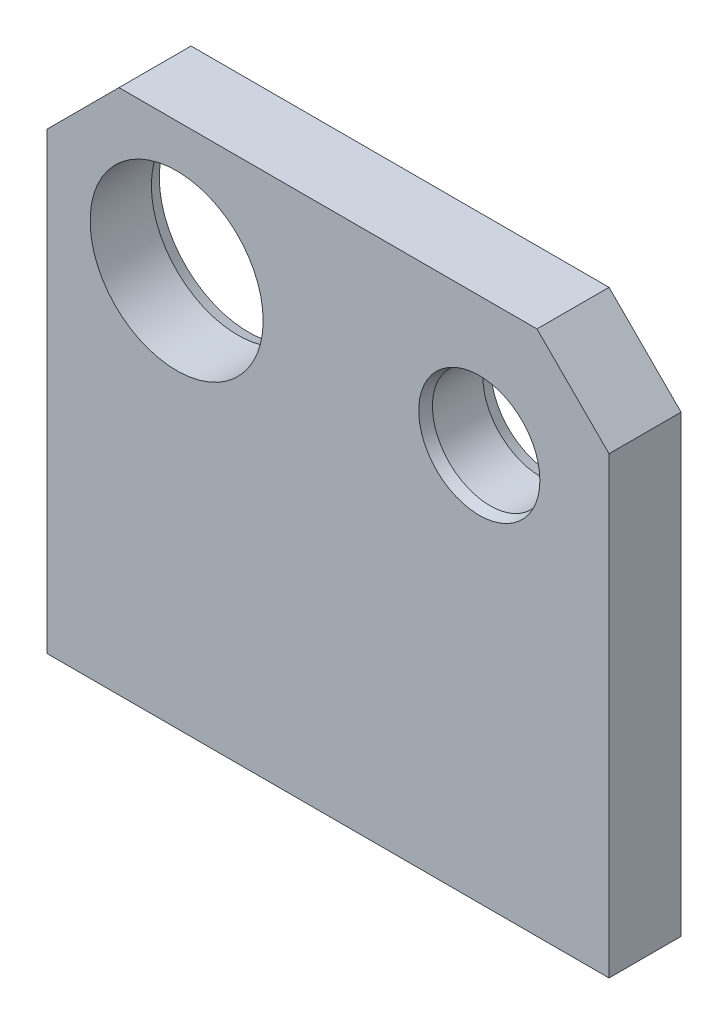
from build123d import *
from OCP.BRepFilletAPI import BRepFilletAPI_MakeChamfer

# Parameters (mm, degrees)
SKETCH1_W             = 78
SKETCH1_H             = 73
EXTRUDE1_DEPTH        = 10
SKETCH3_R             = 12.0065
F_24DIA_HOLE_DEPTH    = 108.29864864
M6_TAPPED_HOLE1_D     = 5
M6_TAPPED_HOLE1_DEPTH = 15
M6_TAPPED_HOLE1_TIP   = 1.502151548
SKETCH7_R             = 8.0045
F_16DIA_HOLE_DEPTH    = 108.29864864
CHAMFER1_SIZE         = 10
CHAMFER2_SIZE         = 1.5
CHAMFER2_SIZE2        = 0.401923789
CHAMFER3_SIZE         = 1.5
CHAMFER3_SIZE2        = 0.401923789


with BuildPart() as part:
    # Sketch1 → Extrude1 (new body)
    with BuildSketch(Plane.XY):
        with Locations((39, 36.5)):
            Rectangle(SKETCH1_W, SKETCH1_H)
    extrude(amount=EXTRUDE1_DEPTH)

    # Sketch3 → 24dia Hole (cut, through all)
    with BuildSketch(Plane.XY.offset(10)):
        with Locations((18, 55)):
            Circle(SKETCH3_R)
    extrude(amount=-F_24DIA_HOLE_DEPTH, mode=Mode.SUBTRACT)

    # M6 Tapped Hole1
    with Locations(Plane(origin=(5, 0, 5), x_dir=(0, 0, -1), z_dir=(0, -1, 0))):
        with Locations((0, 0), (0, 68), (1.921473379, -8.468632325)):
            Hole(M6_TAPPED_HOLE1_D / 2, depth=M6_TAPPED_HOLE1_DEPTH)
            with Locations((0, 0, -(M6_TAPPED_HOLE1_DEPTH + M6_TAPPED_HOLE1_TIP / 2))):  # 118° drill point
                Cone(0, M6_TAPPED_HOLE1_D / 2, M6_TAPPED_HOLE1_TIP, mode=Mode.SUBTRACT)

    # Sketch7 → 16dia hole (cut, through all)
    with BuildSketch(Plane.XY.offset(10)):
        with Locations((60, 55)):
            Circle(SKETCH7_R)
    extrude(amount=-F_16DIA_HOLE_DEPTH, mode=Mode.SUBTRACT)

    # Chamfer1
    chamfer1_edges = [part.edges().sort_by_distance(p)[0] for p in [
        (0, 73, 5),
        (78, 73, 5),
    ]]
    chamfer(chamfer1_edges, length=CHAMFER1_SIZE)

    # Chamfer2: one chamfer whose edges measure the first distance from different faces: ONE call of the kernel's chamfer builder (chamfer() names one face for all edges)
    chamfer2_edges_1 = [part.edges().sort_by_distance(p)[0] for p in [
        (5.9935, 55, 0),
    ]]
    chamfer2_side_1 = [part.faces().sort_by_distance(p)[0] for p in [
        (5.9935, 55, 5),
    ]]
    chamfer2_edges_2 = [part.edges().sort_by_distance(p)[0] for p in [
        (51.9955, 55, 0),
    ]]
    chamfer2_side_2 = [part.faces().sort_by_distance(p)[0] for p in [
        (51.9955, 55, 5),
    ]]
    chamfer2 = BRepFilletAPI_MakeChamfer(part.part.solid().wrapped)
    for e in chamfer2_edges_1:
        chamfer2.Add(CHAMFER2_SIZE, CHAMFER2_SIZE2, e.wrapped, chamfer2_side_1[0].wrapped)  # the first distance lies on this face
    for e in chamfer2_edges_2:
        chamfer2.Add(CHAMFER2_SIZE, CHAMFER2_SIZE2, e.wrapped, chamfer2_side_2[0].wrapped)  # the first distance lies on this face
    add(Compound.cast(chamfer2.Shape()), mode=Mode.REPLACE)

    # Chamfer3
    chamfer3_edges = [part.edges().sort_by_distance(p)[0] for p in [
        (51.9955, 55, 10),
    ]]
    chamfer3_side = [part.faces().sort_by_distance(p)[0] for p in [
        (51.9955, 55, 5.75),
    ]]
    chamfer(chamfer3_edges, length=CHAMFER3_SIZE, length2=CHAMFER3_SIZE2, reference=chamfer3_side[0])


solid = part.part
